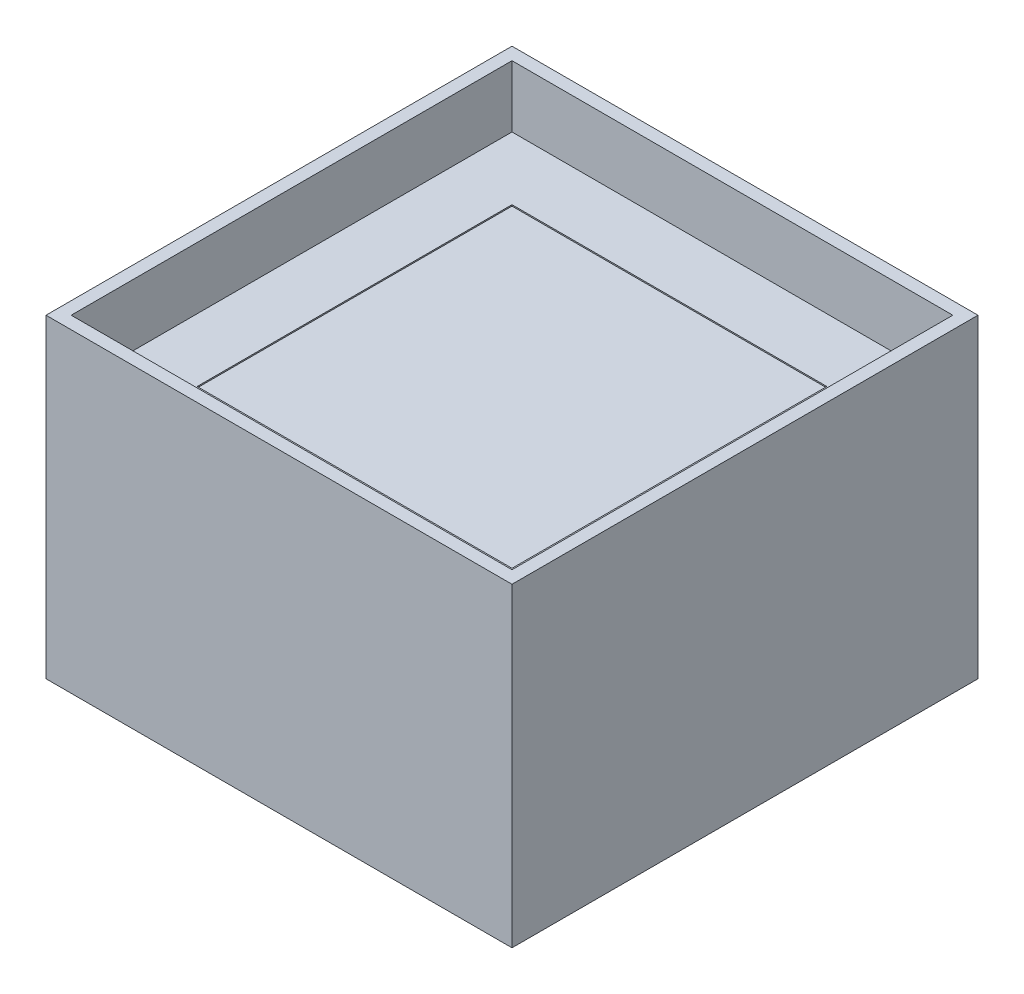
from build123d import *

# Parameters (mm, degrees)
SKETCH_1_W      = 370
SKETCH_1_H      = 370
SKETCH_1_W_2    = 350
SKETCH_1_H_2    = 350
EXTRUDE_1_DEPTH = 50
SKETCH_2_W      = 370
SKETCH_2_H      = 370
EXTRUDE_2_DEPTH = 200
SKETCH_3_W      = 350
SKETCH_3_H      = 350
SKETCH_3_W_2    = 250
SKETCH_3_H_2    = 250
EXTRUDE_3_DEPTH = 1


with BuildPart() as part:
    # 草图1 → 凸台-拉伸1 (new body)
    with BuildSketch(Plane(origin=(0, 0, 0), x_dir=(1, 0, 0), z_dir=(0, 1, 0))):
        Rectangle(SKETCH_1_W, SKETCH_1_H)
        Rectangle(SKETCH_1_W_2, SKETCH_1_H_2, mode=Mode.SUBTRACT)
    extrude(amount=EXTRUDE_1_DEPTH)

    # 草图2 → 凸台-拉伸2 (add)
    with BuildSketch(Plane.XZ):
        Rectangle(SKETCH_2_W, SKETCH_2_H)
    extrude(amount=EXTRUDE_2_DEPTH)

    # 草图3 → 凸台-拉伸3 (add)
    with BuildSketch(Plane(origin=(0, 0, 0), x_dir=(1, 0, 0), z_dir=(0, 1, 0))):
        Rectangle(SKETCH_3_W, SKETCH_3_H)
        Rectangle(SKETCH_3_W_2, SKETCH_3_H_2, mode=Mode.SUBTRACT)
    extrude(amount=EXTRUDE_3_DEPTH)


solid = part.part
